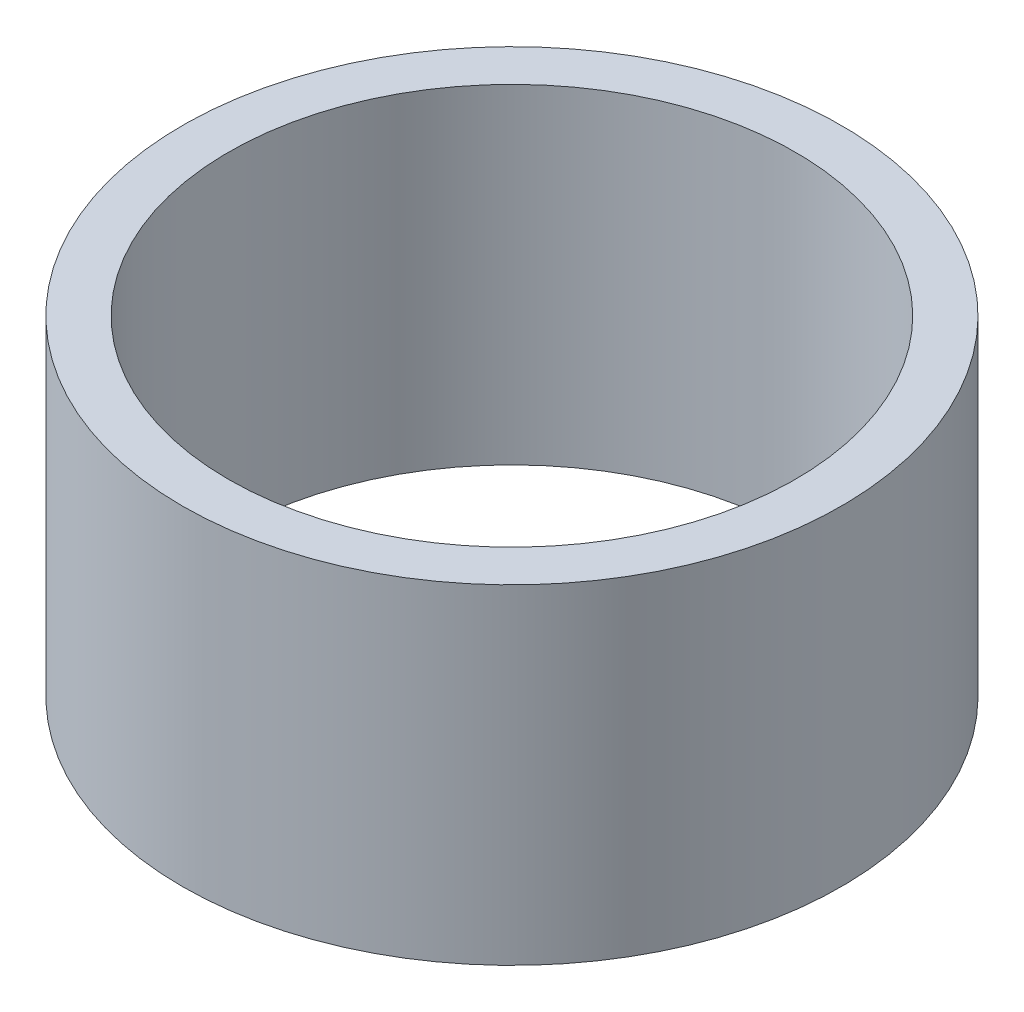
from build123d import *

# Parameters (mm, degrees)
SKETCH1_R           = 5
SKETCH1_R_2         = 4.3
BOSS_EXTRUDE1_DEPTH = 5


with BuildPart() as part:
    # Sketch1 → Boss-Extrude1 (new body)
    with BuildSketch(Plane(origin=(0, 0, 0), x_dir=(1, 0, 0), z_dir=(0, 1, 0))):
        with Locations(Location((0, 0, 0), (0, 0, 270))):
            Circle(SKETCH1_R)
        with Locations(Location((0, 0, 0), (0, 0, 270))):
            Circle(SKETCH1_R_2, mode=Mode.SUBTRACT)
    extrude(amount=BOSS_EXTRUDE1_DEPTH)


solid = part.part
